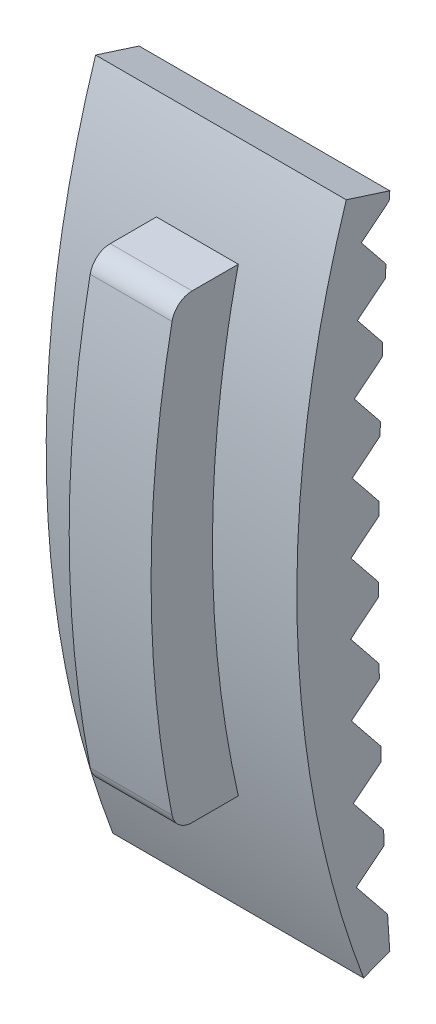
from build123d import *

# Parameters (mm, degrees)
BOSS_EXTRUDE1_DEPTH = 63.5
SKETCH2_W           = 6.985
SKETCH2_H           = 9.525
CUT_EXTRUDE1_DEPTH  = 98.190271375
CUT_EXTRUDE2_DEPTH  = 98.190271375
CUT_EXTRUDE3_DEPTH  = 98.190271375
FILLET1_R           = 2.54
CUT_EXTRUDE4_DEPTH  = 5.08
CUT_EXTRUDE6_DEPTH  = 15.113
FILLET2_R           = 0.508
BOSS_EXTRUDE2_DEPTH = 31.115
BOSS_EXTRUDE3_DEPTH = 5.08
CUT_EXTRUDE7_DEPTH  = 62.449228845
FILLET3_R           = 2.54


with BuildPart() as part:
    # Sketch1 → Boss-Extrude1 (new body)
    with BuildSketch(Plane.XY):
        Polygon((-15.5575, 57.15), (15.5575, 57.15), (15.5575, -57.15), (7.845485509, -57.15), (9.525, -66.675), (-9.525, -66.675), (-7.845485509, -57.15), (-15.5575, -57.15), align=None)
    extrude(amount=BOSS_EXTRUDE1_DEPTH)

    # Sketch2 → Cut-Extrude1 (cut, through all)
    with BuildSketch(Plane(origin=(15.5575, 0, 0), x_dir=(0, 0, -1), z_dir=(1, 0, 0))):
        with Locations((-3.4925, -61.9125)):
            Rectangle(SKETCH2_W, SKETCH2_H)
    extrude(amount=-CUT_EXTRUDE1_DEPTH, mode=Mode.SUBTRACT)

    # Sketch3 → Cut-Extrude2 (cut, through all)
    with BuildSketch(Plane(origin=(15.5575, 0, 0), x_dir=(0, 0, -1), z_dir=(1, 0, 0))):
        with BuildLine():
            Line((-63.5, -66.675), (-63.5, -57.15))
            Line((-63.5, -57.15), (-63.5, 57.15))
            Line((-63.5, 57.15), (-6.541803462, 57.15))
            ThreePointArc((-6.541803462, 57.15), (-48.577712048, 1.473490038), (-63.5, -66.675))
        make_face()
        with BuildLine():
            Line((0, -57.15), (0, 49.180173588))
            ThreePointArc((0, 49.180173588), (-11.476941242, -3.984913206), (0, -57.15))
        make_face()
    extrude(amount=-CUT_EXTRUDE2_DEPTH, mode=Mode.SUBTRACT)

    # Sketch6 → Cut-Extrude3 (cut, through all)
    with BuildSketch(Plane(origin=(15.5575, 0, 0), x_dir=(0, 0, -1), z_dir=(1, 0, 0))):
        with BuildLine():
            ThreePointArc((-47.632075843, -49.890456381), (-52.498873953, -48.968704782), (-54.267408906, -44.34186634))
            ThreePointArc((-54.267408906, -44.34186634), (-39.547918107, 2.686780726), (-10.848565028, 42.745539907))
            ThreePointArc((-10.848565028, 42.745539907), (-19.036412689, 0.07961245), (-13.402903517, -42.998059138))
            ThreePointArc((-13.402903517, -42.998059138), (-14.664693682, -48.027852091), (-19.684337414, -49.329431277))
            ThreePointArc((-19.684337414, -49.329431277), (-33.70089031, -47.483635481), (-47.632075843, -49.890456381))
        make_face()
    extrude(amount=-CUT_EXTRUDE3_DEPTH, mode=Mode.SUBTRACT)

    # Fillet1
    fillet1_edges = [part.edges().sort_by_distance(p)[0] for p in [
        (0, 42.745539907, 10.848565028),
    ]]
    fillet(fillet1_edges, radius=FILLET1_R)

    # Sketch7 → Cut-Extrude4 (cut, symmetric)
    with BuildSketch(Plane(origin=(0, 0, 0), x_dir=(0, 0, -1), z_dir=(1, 0, 0))):
        with BuildLine():
            Line((-19.096941242, 24.590086794), (-8.26917315, 24.590086794))
            ThreePointArc((-8.26917315, 24.590086794), (-11.476941242, -3.984913206), (-8.26917315, -32.559913206))
            Line((-8.26917315, -32.559913206), (-19.096941242, -32.559913206))
            Line((-19.096941242, -32.559913206), (-19.096941242, 24.590086794))
        make_face()
    extrude(amount=CUT_EXTRUDE4_DEPTH, both=True, mode=Mode.SUBTRACT)

    # Sketch10 → Cut-Extrude6 (cut, symmetric)
    with BuildSketch(Plane(origin=(15.5575, 57.15, 6.541803462), x_dir=(-1, 0, 0), z_dir=(0, -0.7729564233131586, -0.6344591142531796))):
        Polygon((0, 5.056529006), (6.985, 5.056529006), (0, -3.769970994), align=None)
        Polygon((31.115, 5.056529006), (31.115, -3.769970994), (24.13, 5.056529006), align=None)
    extrude(amount=CUT_EXTRUDE6_DEPTH, both=True, mode=Mode.SUBTRACT)

    # Fillet2
    fillet2_edges = [part.edges().sort_by_distance(p)[0] for p in [
        (0, 57.15, 6.541803462),
        (-14.065958943, 55.91454615, 7.966671007),
        (14.065958943, 55.91454615, 7.966671007),
        (-15.5575, 4.078442286, 47.351485464),
        (15.5575, 4.078442286, 47.351485464),
    ]]
    fillet(fillet2_edges, radius=FILLET2_R)


with BuildPart() as body_2:
    # Sketch11 → Boss-Extrude2 (new body)
    with BuildSketch(Plane(origin=(15.5575, 0, 0), x_dir=(0, 0, -1), z_dir=(1, 0, 0))):
        with BuildLine():
            Line((-5.34582736, 35.292800385), (0.055075628, 33.564565837))
            ThreePointArc((0.055075628, 33.564565837), (-1.342086932, -7.3188165), (0.055075628, -48.202198838))
            Line((0.055075628, -48.202198838), (-3.199195761, -49.428446626))
            ThreePointArc((-3.199195761, -49.428446626), (-11.435591811, -7.249318258), (-5.34582736, 35.292800385))
        make_face()
    extrude(amount=-BOSS_EXTRUDE2_DEPTH)

    # Sketch13 → Cut-Extrude7 (cut, through all)
    with BuildSketch(Plane(origin=(15.5575, 0, 0), x_dir=(0, 0, -1), z_dir=(1, 0, 0))):
        Polygon((-0.01545939, 32.520387834), (3.046263496, 28.710387834), (-0.418602323, 25.926015399), (-3.480325209, 29.736015399), align=None)
        Polygon((-0.501135954, 24.406767474), (2.645881347, 20.490627326), (-0.818984472, 17.706254892), (-3.966001773, 21.622395039), align=None)
        Polygon((-0.881569002, 16.162182357), (2.354819424, 12.134829013), (-1.110046395, 9.350456578), (-4.346434821, 13.377809922), align=None)
        Polygon((-1.151706999, 7.780346365), (2.178520725, 3.636219644), (-1.286345095, 0.851847209), (-4.616572818, 4.99597393), align=None)
        Polygon((-1.30601154, -0.745632478), (2.122969817, -5.012647965), (-1.341896002, -7.797020399), (-4.770877359, -3.530004913), align=None)
        Polygon((-1.338389041, -9.423337013), (2.194771451, -13.819992745), (-1.270094368, -16.604365179), (-4.80325486, -12.207709448), align=None)
        Polygon((-4.706975335, -21.045514452), (-1.063621254, -25.579294799), (2.401244565, -22.794922364), (-1.242109516, -18.261142017), align=None)
        Polygon((-1.00970931, -27.268335243), (2.750535553, -31.947574174), (-0.714330267, -34.731946609), (-4.474575129, -30.052707677), align=None)
        Polygon((-0.632873728, -36.455263474), (3.25175586, -41.289286435), (-0.213109959, -44.07365887), (-4.097739547, -39.239635909), align=None)
    extrude(amount=-CUT_EXTRUDE7_DEPTH, mode=Mode.SUBTRACT)


with BuildPart() as body_3:
    # Sketch12 → Boss-Extrude3 (new, symmetric)
    with BuildSketch(Plane(origin=(0, 0, 0), x_dir=(0, 0, -1), z_dir=(1, 0, 0))):
        with BuildLine():
            Line((-16.072430628, 24.590086794), (-8.26917315, 24.590086794))
            ThreePointArc((-8.26917315, 24.590086794), (-11.476941242, -3.984913206), (-8.26917315, -32.559913206))
            Line((-8.26917315, -32.559913206), (-16.072430628, -32.559913206))
            ThreePointArc((-16.072430628, -32.559913206), (-19.096941242, -3.984913206), (-16.072430628, 24.590086794))
        make_face()
    extrude(amount=BOSS_EXTRUDE3_DEPTH, both=True)

    # Fillet3
    fillet3_edges = [body_3.edges().sort_by_distance(p)[0] for p in [
        (0, 24.590086794, 16.072430628),
        (0, -32.559913206, 16.072430628),
    ]]
    fillet(fillet3_edges, radius=FILLET3_R)


solid = Compound([body_2.part, body_3.part])
